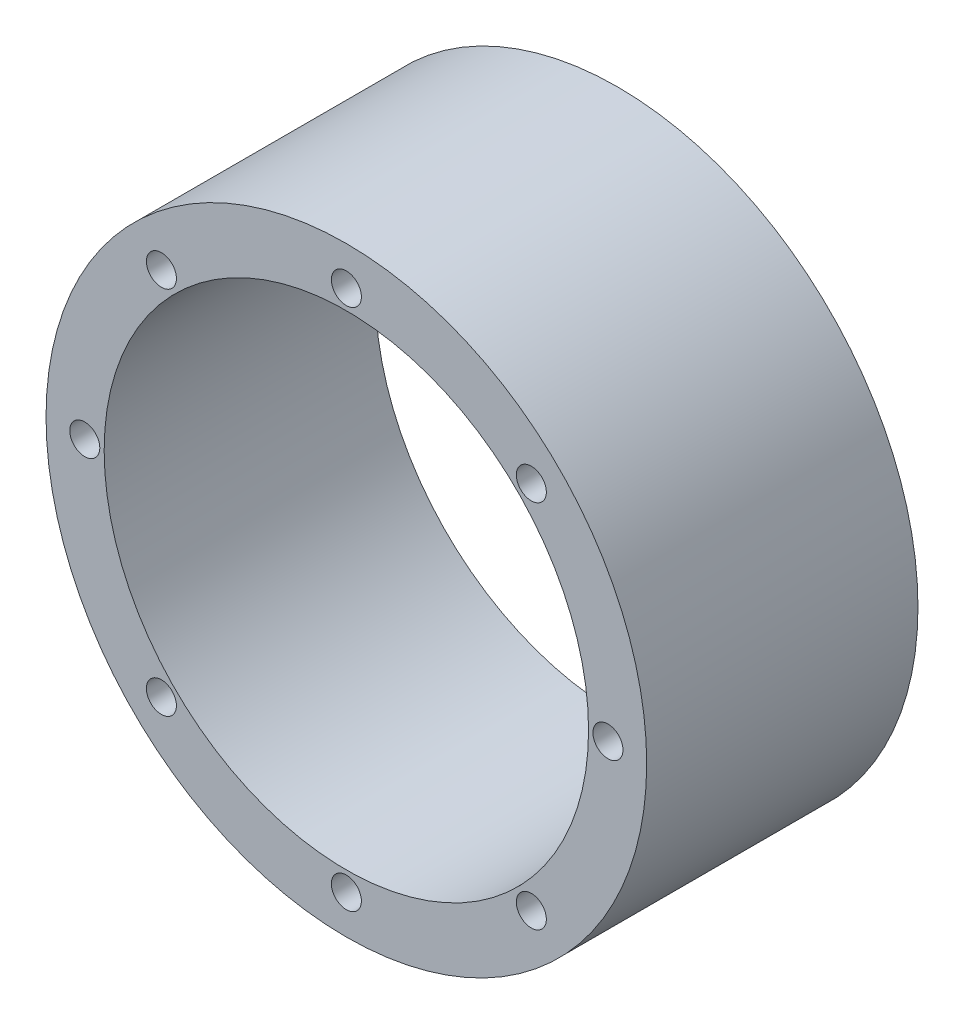
from build123d import *

# Parameters (mm, degrees)
SKETCH1_R           = 31
SKETCH1_R_2         = 1.55
SKETCH1_R_3         = 25
BOSS_EXTRUDE1_DEPTH = 28


with BuildPart() as part:
    # Sketch1 → Boss-Extrude1 (new body)
    with BuildSketch(Plane.XY):
        Circle(SKETCH1_R)
        with Locations((-27, 0)):
            Circle(SKETCH1_R_2, mode=Mode.SUBTRACT)
        with Locations((-19.091883092, 19.091883092)):
            Circle(SKETCH1_R_2, mode=Mode.SUBTRACT)
        with Locations((0, 27)):
            Circle(SKETCH1_R_2, mode=Mode.SUBTRACT)
        with Locations((19.091883092, 19.091883092)):
            Circle(SKETCH1_R_2, mode=Mode.SUBTRACT)
        with Locations((27, 0)):
            Circle(SKETCH1_R_2, mode=Mode.SUBTRACT)
        with Locations((19.091883092, -19.091883092)):
            Circle(SKETCH1_R_2, mode=Mode.SUBTRACT)
        with Locations((0, -27)):
            Circle(SKETCH1_R_2, mode=Mode.SUBTRACT)
        with Locations((-19.091883092, -19.091883092)):
            Circle(SKETCH1_R_2, mode=Mode.SUBTRACT)
        Circle(SKETCH1_R_3, mode=Mode.SUBTRACT)
    extrude(amount=BOSS_EXTRUDE1_DEPTH)


solid = part.part
